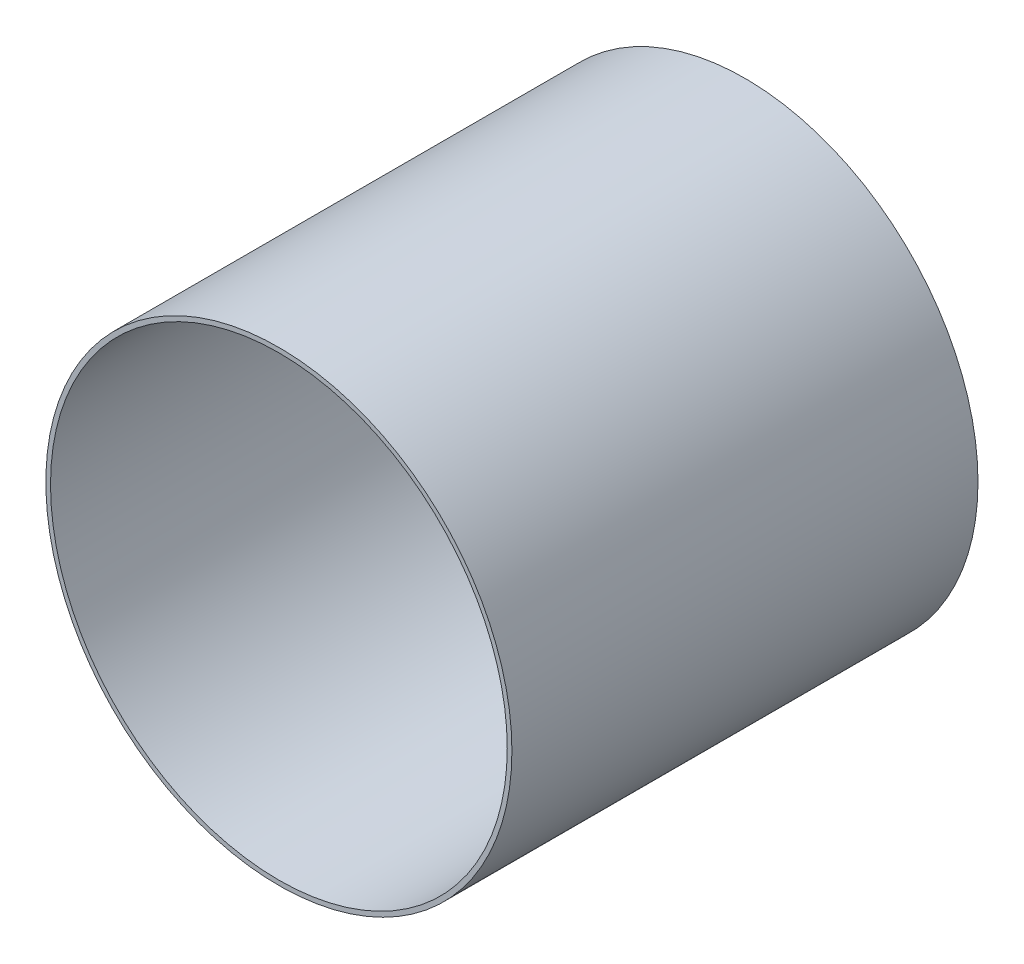
from build123d import *

# Parameters (mm, degrees)
BOSS_EXTRUDE1_DEPTH      = 150
BOSS_EXTRUDE1_DEPTH_BACK = 150
SKETCH1_R                = 150
SKETCH1_R_2              = 147


with BuildPart() as part:
    # Sketch1 → Boss-Extrude1 (new, two sides: drawn at the far end of the back side and taken through both)
    with BuildSketch(Plane.XY.offset(-BOSS_EXTRUDE1_DEPTH_BACK)):
        Circle(SKETCH1_R)
        Circle(SKETCH1_R_2, mode=Mode.SUBTRACT)
    extrude(amount=BOSS_EXTRUDE1_DEPTH + BOSS_EXTRUDE1_DEPTH_BACK)


solid = part.part
